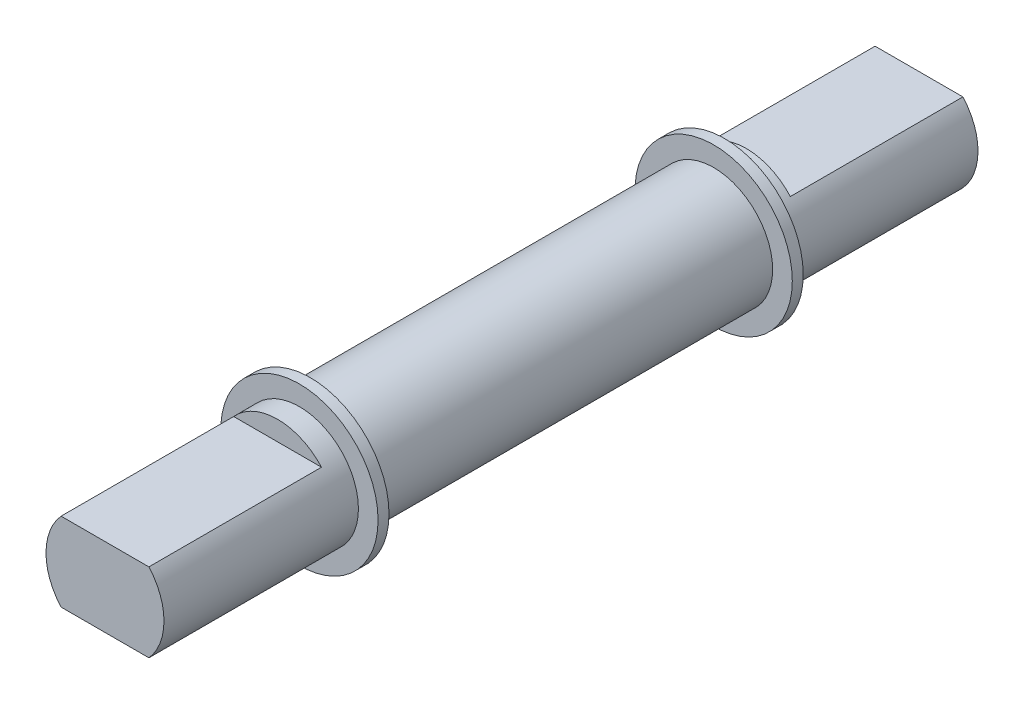
from build123d import *

# Parameters (mm, degrees)
SKETCH1_R           = 2.7
BOSS_EXTRUDE1_DEPTH = 9.23
SKETCH2_R           = 3.6
BOSS_EXTRUDE2_DEPTH = 0.5
BOSS_EXTRUDE3_START = 1
SKETCH3_R           = 2.7
BOSS_EXTRUDE3_DEPTH = 1
BOSS_EXTRUDE4_START = 8.9
BOSS_EXTRUDE4_DEPTH = 8.9


with BuildPart() as part:
    # Sketch1 → Boss-Extrude1 (new, symmetric)
    with BuildSketch(Plane.XY):
        Circle(SKETCH1_R)
    extrude(amount=BOSS_EXTRUDE1_DEPTH, both=True)

    # Sketch2 → Boss-Extrude2 (add)
    with BuildSketch(Plane.XY.offset(9.23)):
        Circle(SKETCH2_R)
    boss_extrude2 = extrude(amount=BOSS_EXTRUDE2_DEPTH)

    # Sketch3 → Boss-Extrude3 (add)
    with BuildSketch(Plane.XY.offset(9.73).offset(BOSS_EXTRUDE3_START)):
        Circle(SKETCH3_R)
    boss_extrude3 = extrude(amount=-BOSS_EXTRUDE3_DEPTH)

    # Sketch3<3> → Boss-Extrude4 (add)
    with BuildSketch(Plane.XY.offset(9.73).offset(BOSS_EXTRUDE4_START)):
        with BuildLine():
            ThreePointArc((-2.01, 1.802747903), (-2.7, 0), (-2.01, -1.802747903))
            Line((-2.01, -1.802747903), (2.01, -1.802747903))
            ThreePointArc((2.01, -1.802747903), (2.7, 0), (2.01, 1.802747903))
            Line((2.01, 1.802747903), (-2.01, 1.802747903))
        make_face()
    boss_extrude4 = extrude(amount=-BOSS_EXTRUDE4_DEPTH)

    # Mirror1: Boss-Extrude2, Boss-Extrude3, Boss-Extrude4 across plane
    add(boss_extrude2.mirror(Plane.XY))
    add(boss_extrude3.mirror(Plane.XY))
    add(boss_extrude4.mirror(Plane.XY))


solid = part.part
